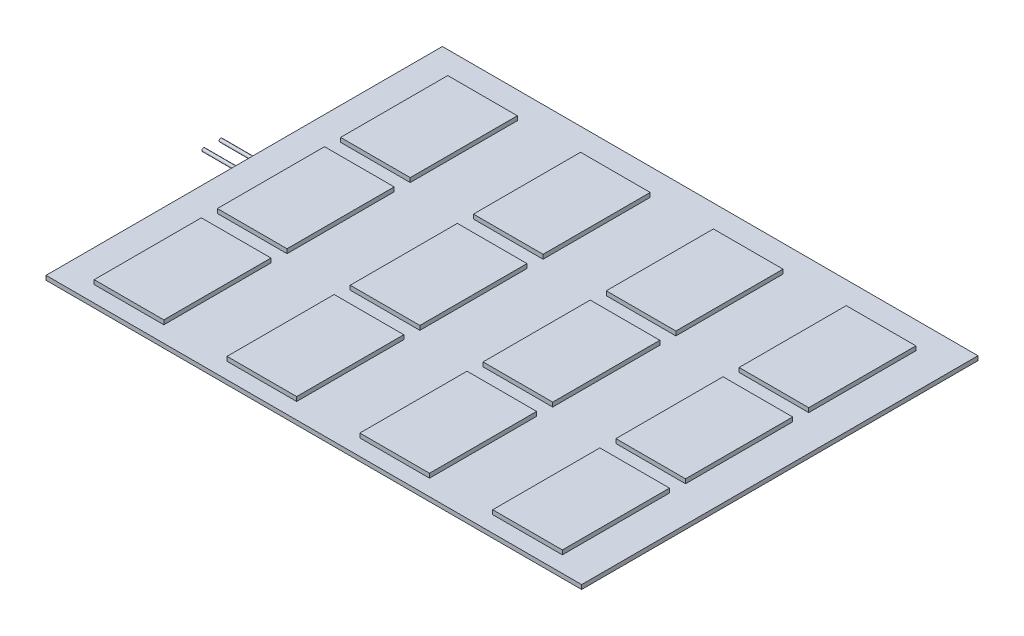
from build123d import *

# Parameters (mm, degrees)
SKETCH1_W            = 500
SKETCH1_H            = 370
PANEL_BASE_DEPTH     = 4
SKETCH2_W            = 65
SKETCH2_H            = 100
SOLAR_ARRAY_DEPTH    = 4
LPATTERN1_COUNT      = 4
LPATTERN1_PITCH      = 124
LPATTERN1_COUNT_DIR2 = 3
LPATTERN1_PITCH_DIR2 = 115
SKETCH3_R            = 1.5
POSITIVE_WIRE_DEPTH  = 30
SKETCH4_R            = 1.5
NEGATIVE_WIRE_DEPTH  = 30


with BuildPart() as part:
    # Sketch1 → panel_base (new body)
    with BuildSketch(Plane(origin=(0, 0, 0), x_dir=(1, 0, 0), z_dir=(0, 1, 0))):
        Rectangle(SKETCH1_W, SKETCH1_H)
    extrude(amount=PANEL_BASE_DEPTH)

    # Sketch2 → solar_array (add)
    with BuildSketch(Plane(origin=(0, 4, 0), x_dir=(1, 0, 0), z_dir=(0, 1, 0))):
        with Locations((-187.5, 110)):
            Rectangle(SKETCH2_W, SKETCH2_H)
    solar_array = extrude(amount=SOLAR_ARRAY_DEPTH)

    # LPattern1: solar_array 4 × 3
    with Locations(*[(i * LPATTERN1_PITCH, 0, j * LPATTERN1_PITCH_DIR2) for i in range(LPATTERN1_COUNT) for j in range(LPATTERN1_COUNT_DIR2) if (i, j) != (0, 0)]):
        add(solar_array)

    # Sketch3 → positive_wire (add)
    with BuildSketch(Plane.ZY.offset(250)):
        with Locations(Location((-8, 1.930294272, 0), (0, 0, 180))):
            Circle(SKETCH3_R)
    extrude(amount=POSITIVE_WIRE_DEPTH)

    # Sketch4 → negative_wire (add)
    with BuildSketch(Plane.ZY.offset(250)):
        with Locations(Location((8, 2.146306887, 0), (0, 0, 180))):
            Circle(SKETCH4_R)
    extrude(amount=NEGATIVE_WIRE_DEPTH)


solid = part.part
